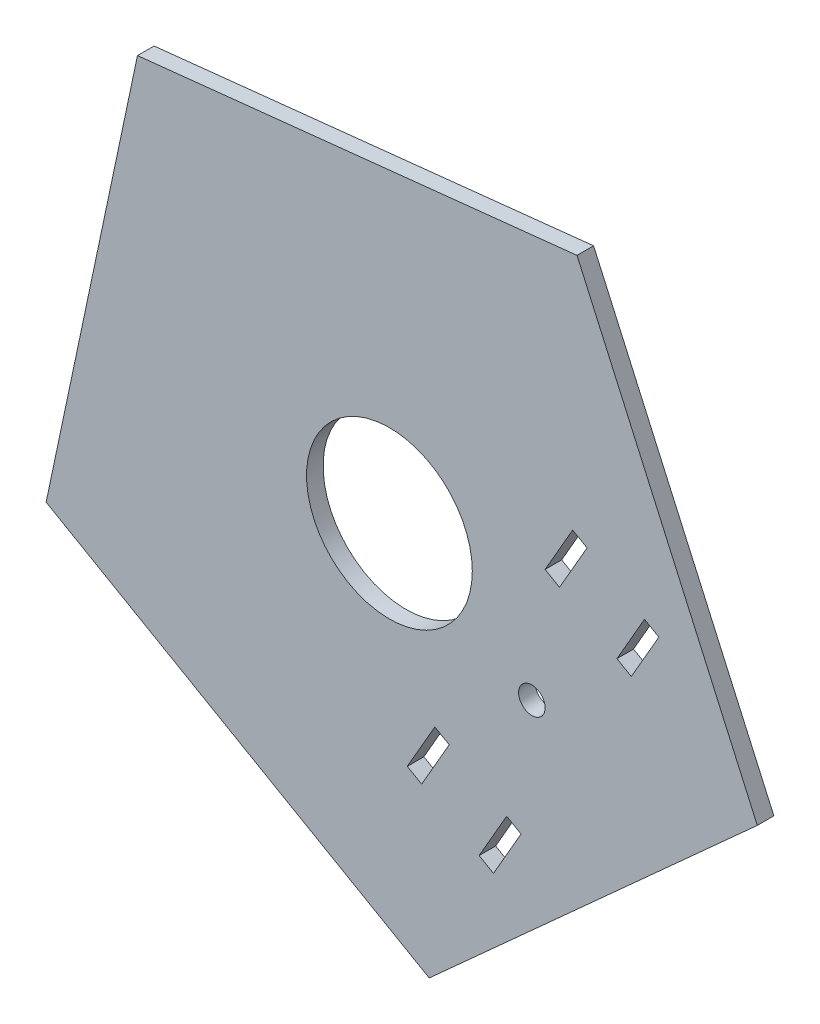
from build123d import *

# Parameters (mm, degrees)
BOSS_EXTRUDE1_DEPTH = 3
SKETCH3_R           = 15
CUT_EXTRUDE1_DEPTH  = 3
CUT_EXTRUDE3_DEPTH  = 3
SKETCH7_R           = 2.4
CUT_EXTRUDE4_DEPTH  = 3


with BuildPart() as part:
    # Sketch1 → Boss-Extrude1 (new body)
    with BuildSketch(Plane.XY):
        Polygon((-62.133450379, -27.758203286), (7.199328029, -67.670179411), (66.582879797, -14.064267615), (33.951154754, 58.977983998), (-45.599912202, 50.514666314), align=None)
    extrude(amount=BOSS_EXTRUDE1_DEPTH)

    # Sketch3 → Cut-Extrude1 (cut)
    with BuildSketch(Plane.XY.offset(3)):
        Circle(SKETCH3_R)
    extrude(amount=-CUT_EXTRUDE1_DEPTH, mode=Mode.SUBTRACT)

    # Sketch5 → Cut-Extrude3 (cut)
    with BuildSketch(Plane.XY.offset(3)):
        Polygon((28.177848363, 6.856300869), (33.166845379, 15.52289817), (35.766824569, 14.026199065), (30.777827554, 5.359601764), align=None)
        Polygon((41.177744315, -0.627194654), (46.166741331, 8.039402647), (48.766720521, 6.542703542), (43.777723505, -2.123893759), align=None)
        Polygon((10.821839491, -29.30678744), (5.832842475, -37.973384741), (3.232863285, -36.476685636), (8.221860301, -27.810088335), align=None)
        Polygon((23.821735443, -36.790282963), (18.832738427, -45.456880264), (16.232759237, -43.960181159), (21.221756252, -35.293583858), align=None)
    extrude(amount=-CUT_EXTRUDE3_DEPTH, mode=Mode.SUBTRACT)

    # Sketch7 → Cut-Extrude4 (cut)
    with BuildSketch(Plane(origin=(0, 0, 0), x_dir=(-1, 0, 0), z_dir=(0, 0, -1))):
        with Locations((-25.78312697, -14.842266122)):
            Circle(SKETCH7_R)
    extrude(amount=-CUT_EXTRUDE4_DEPTH, mode=Mode.SUBTRACT)


solid = part.part
